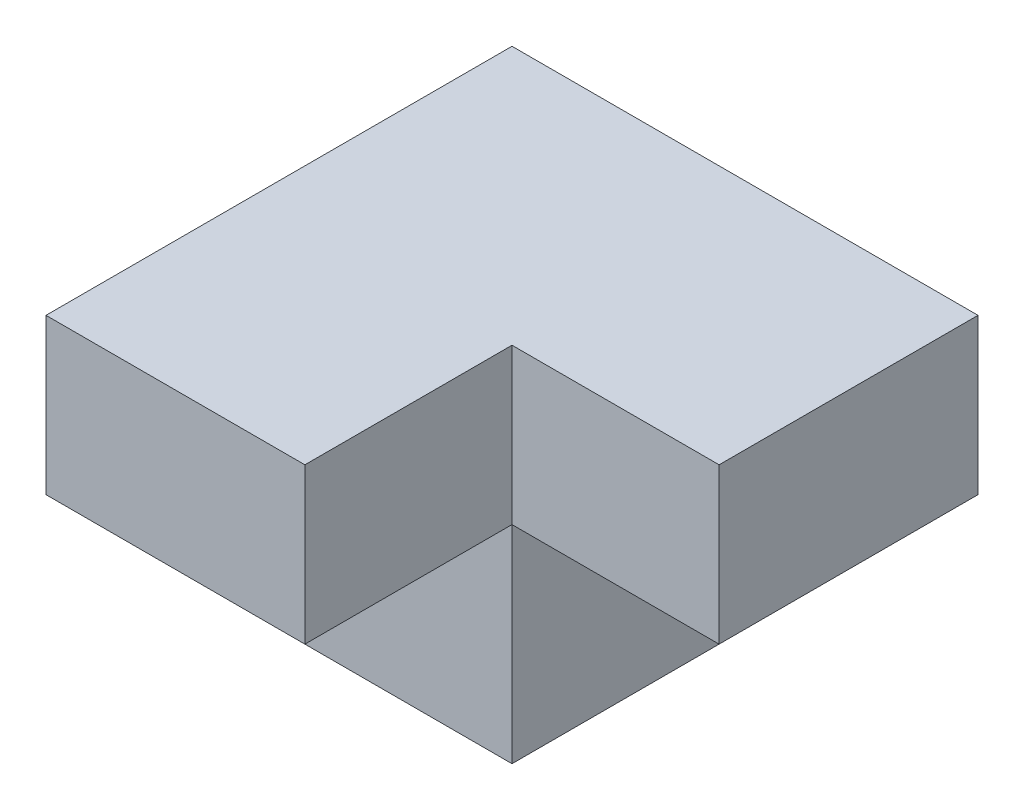
from build123d import *

# Parameters (mm, degrees)
BOSS_EXTRUDE1_DEPTH      = 15
BOSS_EXTRUDE1_DEPTH_BACK = 20
SKETCH3_W                = 25
SKETCH3_H                = 25
CUT_EXTRUDE1_DEPTH       = 30
SKETCH5_W                = 25
SKETCH5_H                = 15
BOSS_EXTRUDE2_DEPTH      = 20
SKETCH6_W                = 25
SKETCH6_H                = 15
BOSS_EXTRUDE3_DEPTH      = 20


with BuildPart() as part:
    # Sketch3 → Boss-Extrude1 (new, two sides: drawn at the far end of the back side and taken through both)
    with BuildSketch(Plane(origin=(0, 0, 0), x_dir=(1, 0, 0), z_dir=(0, 1, 0)).offset(-BOSS_EXTRUDE1_DEPTH_BACK)):
        Rectangle(SKETCH3_W, SKETCH3_H)
    extrude(amount=BOSS_EXTRUDE1_DEPTH + BOSS_EXTRUDE1_DEPTH_BACK)

    # Extrusion Profile → Cut-Extrude1 (cut)
    with BuildSketch(Plane(origin=(0, -20, 0), x_dir=(-1, 0, 0), z_dir=(0, -1, 0))):
        with BuildLine():
            Line((4.4, -0.002893219), (4.397106781, 0))
            Line((4.397106781, 0), (4.4, 0.002893219))
            Line((4.4, 0.002893219), (4.4, 2.632233047))
            Line((4.4, 2.632233047), (6.767766953, 5))
            Line((6.767766953, 5), (7.7, 5))
            Line((7.7, 5), (7.7, 2.625))
            Line((7.7, 2.625), (8.752106781, 2.625))
            Line((8.752106781, 2.625), (10.5, 4.372893219))
            Line((10.5, 4.372893219), (10.5, 9.5))
            ThreePointArc((10.5, 9.5), (10.207106781, 10.207106781), (9.5, 10.5))
            Line((9.5, 10.5), (4.372893219, 10.5))
            Line((4.372893219, 10.5), (2.625, 8.752106781))
            Line((2.625, 8.752106781), (2.625, 7.7))
            Line((2.625, 7.7), (5, 7.7))
            Line((5, 7.7), (5, 6.767766953))
            Line((5, 6.767766953), (2.632233047, 4.4))
            Line((2.632233047, 4.4), (0.002893219, 4.4))
            Line((0.002893219, 4.4), (0, 4.397106781))
            Line((0, 4.397106781), (-0.002893219, 4.4))
            Line((-0.002893219, 4.4), (-2.632233047, 4.4))
            Line((-2.632233047, 4.4), (-5, 6.767766953))
            Line((-5, 6.767766953), (-5, 7.7))
            Line((-5, 7.7), (-2.625, 7.7))
            Line((-2.625, 7.7), (-2.625, 8.752106781))
            Line((-2.625, 8.752106781), (-4.372893219, 10.5))
            Line((-4.372893219, 10.5), (-9.5, 10.5))
            ThreePointArc((-9.5, 10.5), (-10.207106781, 10.207106781), (-10.5, 9.5))
            Line((-10.5, 9.5), (-10.5, 4.372893219))
            Line((-10.5, 4.372893219), (-8.752106781, 2.625))
            Line((-8.752106781, 2.625), (-7.7, 2.625))
            Line((-7.7, 2.625), (-7.7, 5))
            Line((-7.7, 5), (-6.767766953, 5))
            Line((-6.767766953, 5), (-4.4, 2.632233047))
            Line((-4.4, 2.632233047), (-4.4, 0.002893219))
            Line((-4.4, 0.002893219), (-4.397106781, 0))
            Line((-4.397106781, 0), (-4.4, -0.002893219))
            Line((-4.4, -0.002893219), (-4.4, -2.632233047))
            Line((-4.4, -2.632233047), (-6.767766953, -5))
            Line((-6.767766953, -5), (-7.7, -5))
            Line((-7.7, -5), (-7.7, -2.625))
            Line((-7.7, -2.625), (-8.752106781, -2.625))
            Line((-8.752106781, -2.625), (-10.5, -4.372893219))
            Line((-10.5, -4.372893219), (-10.5, -9.5))
            ThreePointArc((-10.5, -9.5), (-10.207106781, -10.207106781), (-9.5, -10.5))
            Line((-9.5, -10.5), (-4.372893219, -10.5))
            Line((-4.372893219, -10.5), (-2.625, -8.752106781))
            Line((-2.625, -8.752106781), (-2.625, -7.7))
            Line((-2.625, -7.7), (-5, -7.7))
            Line((-5, -7.7), (-5, -6.767766953))
            Line((-5, -6.767766953), (-2.632233047, -4.4))
            Line((-2.632233047, -4.4), (-0.002893219, -4.4))
            Line((-0.002893219, -4.4), (0, -4.397106781))
            Line((0, -4.397106781), (0.002893219, -4.4))
            Line((0.002893219, -4.4), (2.632233047, -4.4))
            Line((2.632233047, -4.4), (5, -6.767766953))
            Line((5, -6.767766953), (5, -7.7))
            Line((5, -7.7), (2.625, -7.7))
            Line((2.625, -7.7), (2.625, -8.752106781))
            Line((2.625, -8.752106781), (4.372893219, -10.5))
            Line((4.372893219, -10.5), (9.5, -10.5))
            ThreePointArc((9.5, -10.5), (10.207106781, -10.207106781), (10.5, -9.5))
            Line((10.5, -9.5), (10.5, -4.372893219))
            Line((10.5, -4.372893219), (8.752106781, -2.625))
            Line((8.752106781, -2.625), (7.7, -2.625))
            Line((7.7, -2.625), (7.7, -5))
            Line((7.7, -5), (6.767766953, -5))
            Line((6.767766953, -5), (4.4, -2.632233047))
            Line((4.4, -2.632233047), (4.4, -0.002893219))
        make_face()
    extrude(amount=-CUT_EXTRUDE1_DEPTH, mode=Mode.SUBTRACT)

    # Sketch5 → Boss-Extrude2 (add)
    with BuildSketch(Plane.XY.offset(12.5)):
        with Locations((0, 7.5)):
            Rectangle(SKETCH5_W, SKETCH5_H)
    extrude(amount=BOSS_EXTRUDE2_DEPTH)

    # Sketch6 → Boss-Extrude3 (add)
    with BuildSketch(Plane(origin=(12.5, 0, 0), x_dir=(0, 0, -1), z_dir=(1, 0, 0))):
        with Locations((0, 7.5)):
            Rectangle(SKETCH6_W, SKETCH6_H)
    extrude(amount=BOSS_EXTRUDE3_DEPTH)


solid = part.part
